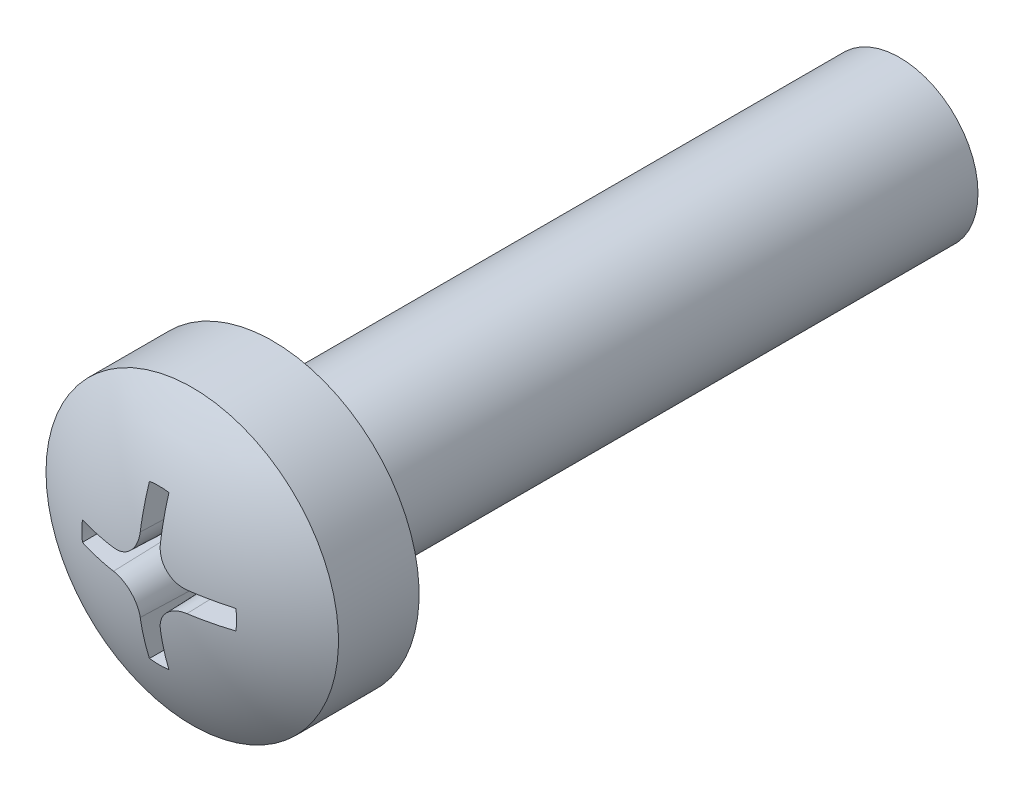
from build123d import *

# Parameters (mm, degrees)
SKETCH1_R          = 1.5
BASE_EXTRUDE_DEPTH = 12
CUT_EXTRUDE1_DEPTH = 1.799999969
CUT_EXTRUDE1_TAPER = 2


with BuildPart() as part:
    # Sketch1 → Base-Extrude (new body)
    with BuildSketch(Plane.XY):
        Circle(SKETCH1_R)
    extrude(amount=BASE_EXTRUDE_DEPTH)

    # Sketch6 → Boss-Revolve2 (revolve)
    with BuildSketch(Plane(origin=(0, 0, 0), x_dir=(1, 0, 0), z_dir=(0, 1, 0)), mode=Mode.PRIVATE) as boss_revolve2_sk:
        with BuildLine():
            Line((0, -12), (2.7999999, -12))
            Line((2.7999999, -12), (2.7999999, -13.54246308))
            ThreePointArc((2.7999999, -13.54246308), (1.46418655, -14.180811406), (0, -14.4))
            Line((0, -14.4), (0, -12))
        make_face()
    revolve(boss_revolve2_sk.sketch.rotate(Axis((0, 0, -0.393620135), (0, 0, 1)), 180), axis=Axis((0, 0, -0.393620135), (0, 0, 1)))

    # Sketch7 → Cut-Extrude1 (cut)
    with BuildSketch(Plane(origin=(0, 0, 14.7000001), x_dir=(-1, 0, 0), z_dir=(0, 0, -1))):
        with BuildLine():
            ThreePointArc((0.205000004, 1.48592565), (0, 1.500000013), (-0.205000004, 1.48592565))
            Line((-0.205000004, 1.48592565), (-0.205000004, 0.708178558))
            ThreePointArc((-0.205000004, 0.708178558), (-0.35072876, 0.355344481), (-0.702967546, 0.208182689))
            Line((-0.702967546, 0.208182689), (-1.48592565, 0.205000004))
            ThreePointArc((-1.48592565, 0.205000004), (-1.500000013, 0), (-1.48592565, -0.205000004))
            Line((-1.48592565, -0.205000004), (-0.702967546, -0.208182689))
            ThreePointArc((-0.702967546, -0.208182689), (-0.35072876, -0.355344481), (-0.205000004, -0.708178558))
            Line((-0.205000004, -0.708178558), (-0.205000004, -1.48592565))
            ThreePointArc((-0.205000004, -1.48592565), (0, -1.500000013), (0.205000004, -1.48592565))
            Line((0.205000004, -1.48592565), (0.205000004, -0.708178558))
            ThreePointArc((0.205000004, -0.708178558), (0.35072876, -0.355344481), (0.702967546, -0.208182689))
            Line((0.702967546, -0.208182689), (1.48592565, -0.205000004))
            ThreePointArc((1.48592565, -0.205000004), (1.500000013, 0), (1.48592565, 0.205000004))
            Line((1.48592565, 0.205000004), (0.702967546, 0.208182689))
            ThreePointArc((0.702967546, 0.208182689), (0.35072876, 0.355344481), (0.205000004, 0.708178558))
            Line((0.205000004, 0.708178558), (0.205000004, 1.48592565))
        make_face()
    extrude(amount=CUT_EXTRUDE1_DEPTH, taper=CUT_EXTRUDE1_TAPER, mode=Mode.SUBTRACT)


solid = part.part
